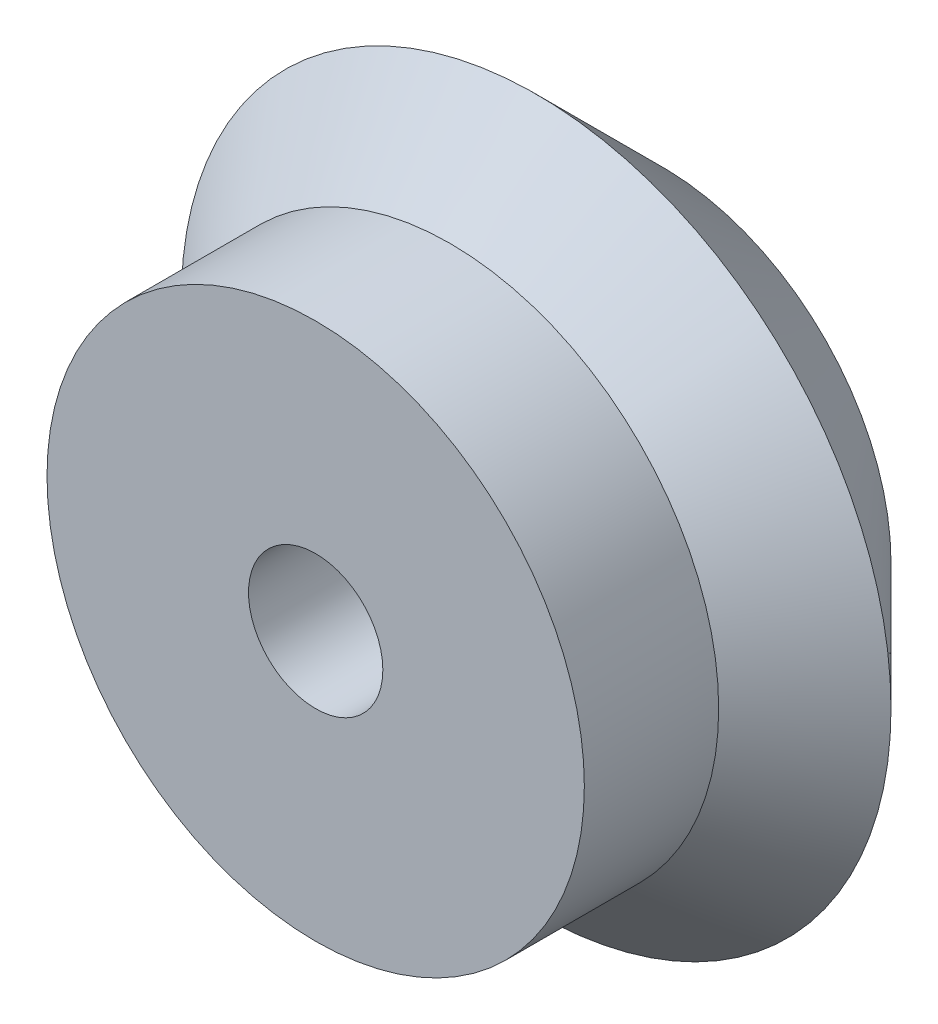
from build123d import *

# Parameters (mm, degrees)
SKETCH1_R           = 30
SKETCH1_R_2         = 7.5
BOSS_EXTRUDE1_DEPTH = 15


with BuildPart() as part:
    # Sketch1 → Boss-Extrude1 (new body)
    with BuildSketch(Plane.XY):
        Circle(SKETCH1_R)
        Circle(SKETCH1_R_2, mode=Mode.SUBTRACT)
    extrude(amount=BOSS_EXTRUDE1_DEPTH)

    # Sketch2 → Revolve4 (revolve)
    with BuildSketch(Plane(origin=(0, 0, 0), x_dir=(1, 0, 0), z_dir=(0, 1, 0))):
        Polygon((7.5, 0), (30, 0), (39.62, 9.62), (25.477864376, 23.762135624), (17.967751926, 17), (7.5, 17), align=None)
    revolve(axis=Axis((0, 0, 0), (0, 0, -1)))


solid = part.part
